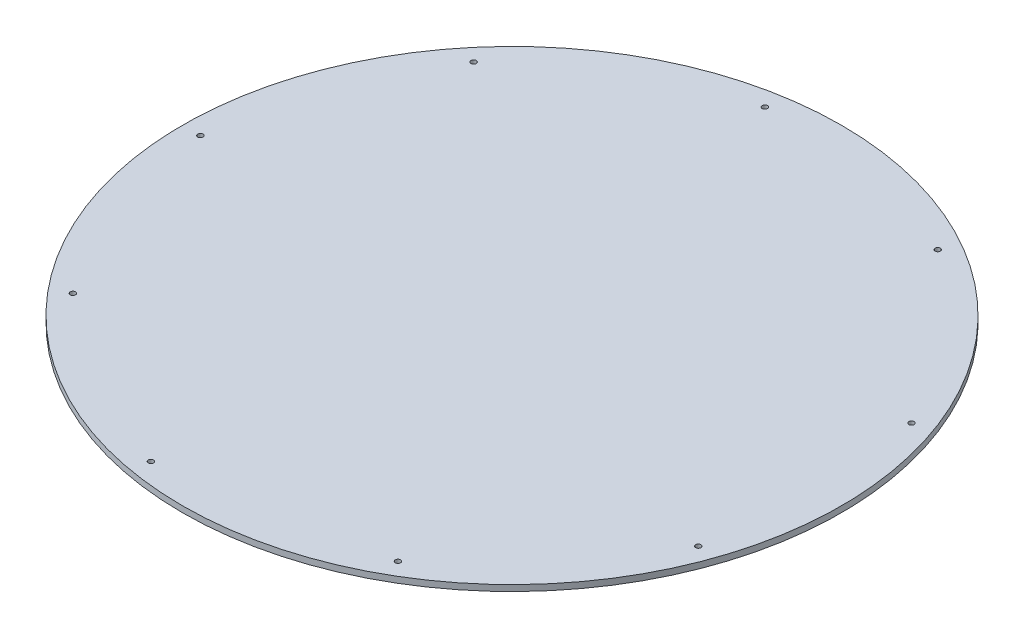
from build123d import *

# Parameters (mm, degrees)
SKETCH1_R           = 318.262
BOSS_EXTRUDE1_DEPTH = 5.842
SKETCH2_R           = 2.5527
CUT_EXTRUDE1_DEPTH  = 451.128348643
CIRPATTERN1_COUNT   = 9


with BuildPart() as part:
    # Sketch1 → Boss-Extrude1 (new body)
    with BuildSketch(Plane(origin=(0, 0, 0), x_dir=(1, 0, 0), z_dir=(0, 1, 0))):
        Circle(SKETCH1_R)
    extrude(amount=BOSS_EXTRUDE1_DEPTH)

    # Sketch2 → Cut-Extrude1 (cut, through all)
    with BuildSketch(Plane(origin=(0, 5.842, 0), x_dir=(1, 0, 0), z_dir=(0, 1, 0))):
        with Locations((-300.99, 0)):
            Circle(SKETCH2_R)
    cut_extrude1 = extrude(amount=-CUT_EXTRUDE1_DEPTH, mode=Mode.SUBTRACT)

    # CirPattern1: Cut-Extrude1 ×9 about axis
    cirpattern1_axis = Axis((0, 6.6675, 0), (0, -1, 0))
    for i in range(1, CIRPATTERN1_COUNT):
        add(cut_extrude1.rotate(cirpattern1_axis, i * 360 / CIRPATTERN1_COUNT), mode=Mode.SUBTRACT)


solid = part.part
